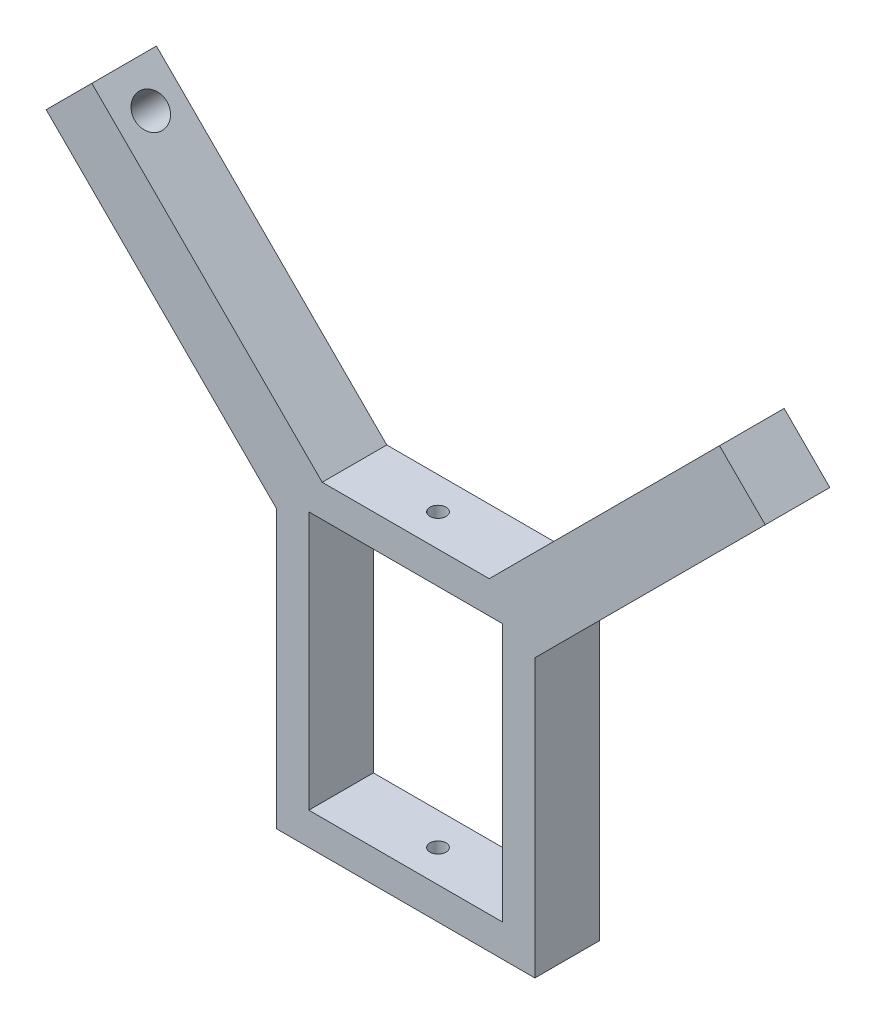
from build123d import *

# Parameters (mm, degrees)
SKETCH1_W               = 80
SKETCH1_H               = 100
SKETCH1_W_2             = 60
SKETCH1_H_2             = 80
EXTRUDE_THIN1_DEPTH     = 10
BOSS_EXTRUDE1_DEPTH     = 10
CUT_EXTRUDE1_REACH      = 200.286
SKETCH3_R               = 5
CUT_EXTRUDE2_DEPTH      = 191.061213228
CUT_EXTRUDE2_DEPTH_BACK = 191.061213228
SKETCH4_R               = 2.5


with BuildPart() as part:
    # Sketch1 → Extrude-Thin1 (new, symmetric)
    with BuildSketch(Plane.XY):
        with Locations((50, -140)):
            Rectangle(SKETCH1_W, SKETCH1_H)
        with Locations((50, -140)):
            Rectangle(SKETCH1_W_2, SKETCH1_H_2, mode=Mode.SUBTRACT)
    extrude(amount=EXTRUDE_THIN1_DEPTH, both=True)

    # Sketch2 → Boss-Extrude1 (add, symmetric)
    with BuildSketch(Plane.XY):
        Polygon((27.071067812, -92.928932188), (-47.175144213, -18.682720164), (-61.317279836, -32.824855787), (12.928932188, -107.071067812), align=None)
    boss_extrude1 = extrude(amount=BOSS_EXTRUDE1_DEPTH, both=True)

    # Sketch3 → Cut-Extrude1 (cut, up to next)
    with BuildSketch(Plane(origin=(-47.071067812, -47.071067812, 0), x_dir=(0, 0, 1), z_dir=(-0.7071067811865477, -0.7071067811865475, 0)), mode=Mode.PRIVATE) as cut_extrude1_sk1:
        with Locations(Location((0, 8.485281374, 0), (0, 0, 270))):
            Circle(SKETCH3_R)
    cut_extrude1_tool1 = extrude(cut_extrude1_sk1.sketch, amount=-CUT_EXTRUDE1_REACH, mode=Mode.PRIVATE) & part.part
    cut_extrude1 = cut_extrude1_tool1.solids().sort_by_distance((-53.071068, -41.071068, 0))[0]
    add(cut_extrude1, mode=Mode.SUBTRACT)

    # Mirror1: Boss-Extrude1, Cut-Extrude1 across plane
    add(boss_extrude1.mirror(Plane(origin=(50, 0, 0), x_dir=(0, 0, 1), z_dir=(1, 0, 0))))
    add(cut_extrude1.mirror(Plane(origin=(50, 0, 0), x_dir=(0, 0, 1), z_dir=(1, 0, 0))), mode=Mode.SUBTRACT)

    # Sketch4 → Cut-Extrude2 (cut, two sides: drawn at the far end of the back side and taken through both)
    with BuildSketch(Plane(origin=(0, -90, 0), x_dir=(1, 0, 0), z_dir=(0, 1, 0)).offset(-CUT_EXTRUDE2_DEPTH_BACK)):
        with Locations(Location((50, 0, 0), (0, 0, 270))):
            Circle(SKETCH4_R)
    extrude(amount=CUT_EXTRUDE2_DEPTH + CUT_EXTRUDE2_DEPTH_BACK, mode=Mode.SUBTRACT)


solid = part.part
